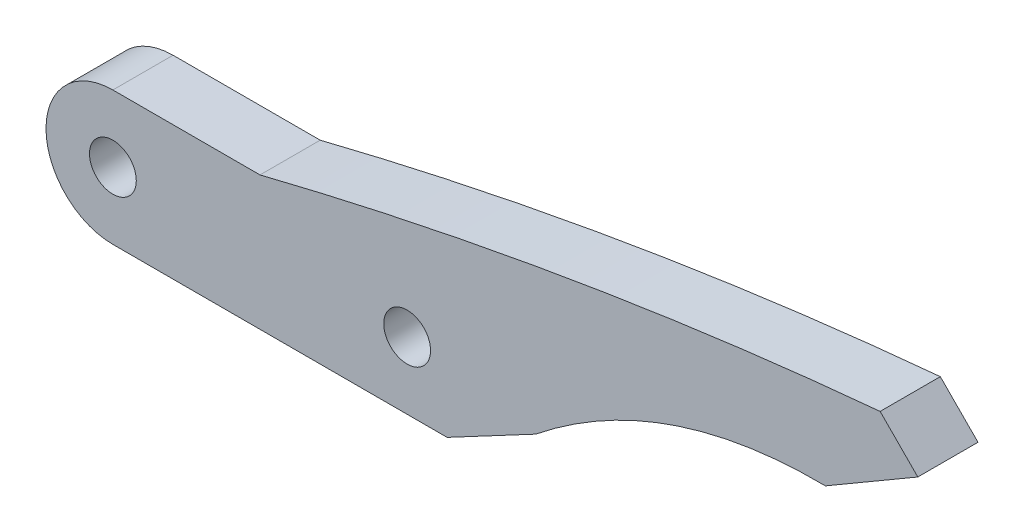
from build123d import *

# Parameters (mm, degrees)
SKETCH2_R           = 5
SKETCH2_R_2         = 1.75
BOSS_EXTRUDE3_DEPTH = 4.5
BOSS_EXTRUDE4_START = -4.5
BOSS_EXTRUDE4_DEPTH = 4.5


with BuildPart() as part:
    # Sketch2 → Boss-Extrude3 (new body)
    # profile 1 of 3: a face of its own
    with BuildSketch(Plane.XY):
        with BuildLine():
            Line((-11, -5), (11, -5))
            ThreePointArc((11, -5), (6, 0), (11, 5))
            Line((11, 5), (-11, 5))
            ThreePointArc((-11, 5), (-7.464466094, 3.535533906), (-6, 0))
            ThreePointArc((-6, 0), (-7.464466094, -3.535533906), (-11, -5))
        make_face()
    # profile 2 of 3: a face of its own
    with BuildSketch(Plane.XY):
        with Locations((-11, 0)):
            Circle(SKETCH2_R)
        with Locations((-11, 0)):
            Circle(SKETCH2_R_2, mode=Mode.SUBTRACT)
    # profile 3 of 3: a face of its own
    with BuildSketch(Plane.XY):
        with Locations((11, 0)):
            Circle(SKETCH2_R)
        with Locations((11, 0)):
            Circle(SKETCH2_R_2, mode=Mode.SUBTRACT)
    extrude(amount=BOSS_EXTRUDE3_DEPTH)

    # Sketch3 → Boss-Extrude4 (add)
    with BuildSketch(Plane.XY.offset(4.5).offset(BOSS_EXTRUDE4_START)):
        with BuildLine():
            Line((49.180795902, 10.03), (42.27, 6))
            add(Edge.make_bspline(
                [(42.27, 6), (30.146150748, 6.157348305), (20.61, -1.48)],
                knots=[0, 0, 0, 1, 1, 1], degree=2))
            Line((20.61, -1.48), (13.99, -5))
            Line((13.99, -5), (11, -5))
            ThreePointArc((11, -5), (16, 0), (11, 5))
            Line((11, 5), (0, 5))
            add(Edge.make_bspline(
                [(0, 5), (22.885517501, 10.707926651), (46.363989199, 12.87)],
                knots=[0, 0, 0, 1, 1, 1], degree=2))
            Line((46.363989199, 12.87), (49.180795902, 10.03))
        make_face()
    extrude(amount=BOSS_EXTRUDE4_DEPTH)


solid = part.part
